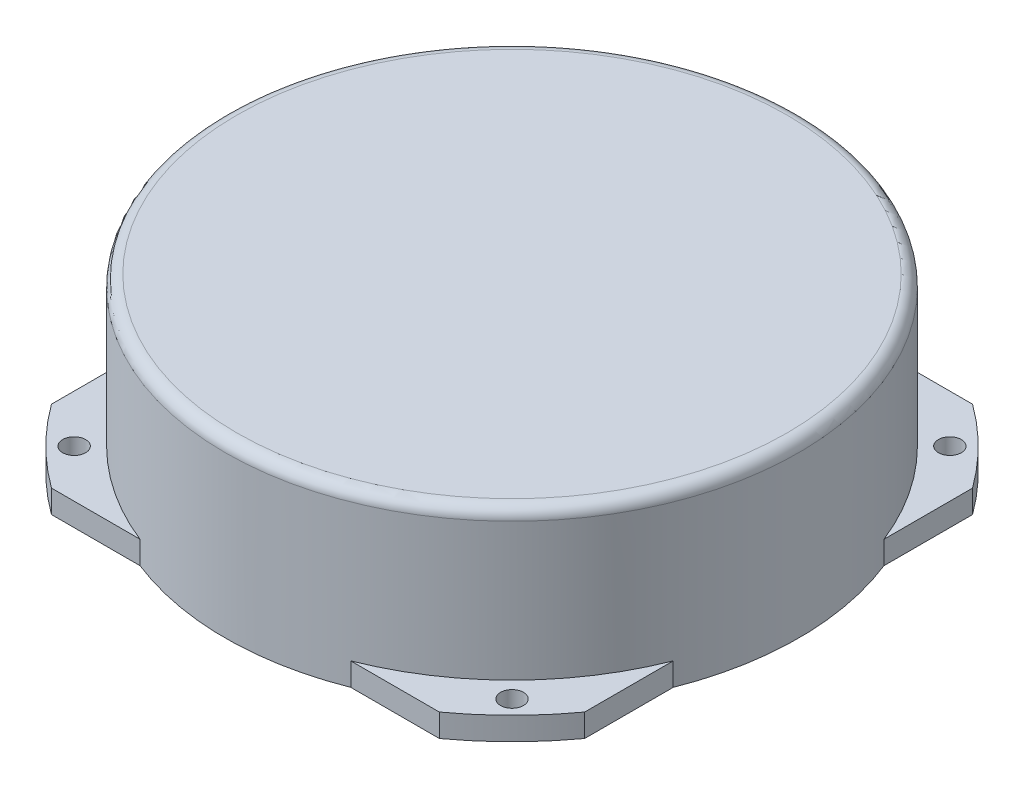
from build123d import *

# Parameters (mm, degrees)
SKETCH1_R           = 50
BOSS_EXTRUDE1_DEPTH = 30
SKETCH1_3_R         = 2
BOSS_EXTRUDE2_DEPTH = 4
FILLET2_R           = 2


with BuildPart() as part:
    # Sketch1 → Boss-Extrude1 (new body)
    with BuildSketch(Plane(origin=(0, 0, 0), x_dir=(1, 0, 0), z_dir=(0, 1, 0))):
        Circle(SKETCH1_R)
    extrude(amount=BOSS_EXTRUDE1_DEPTH)

    # Sketch1<3> → Boss-Extrude2 (add)
    # profile 1 of 4: a face of its own
    with BuildSketch(Plane(origin=(0, 0, 0), x_dir=(1, 0, 0), z_dir=(0, 1, 0))):
        with BuildLine():
            Line((-33.823069051, -46.5), (-18.377975949, -46.5))
            ThreePointArc((-18.377975949, -46.5), (-35.355339059, -35.355339059), (-46.5, -18.377975949))
            Line((-46.5, -18.377975949), (-46.5, -33.823069051))
            ThreePointArc((-46.5, -33.823069051), (-40.658639918, -40.658639918), (-33.823069051, -46.5))
        make_face()
        with Locations((-38.183766184, -38.183766184)):
            Circle(SKETCH1_3_R, mode=Mode.SUBTRACT)
    # profile 2 of 4: a face of its own
    with BuildSketch(Plane(origin=(0, 0, 0), x_dir=(1, 0, 0), z_dir=(0, 1, 0))):
        with BuildLine():
            ThreePointArc((46.5, -18.377975949), (35.355339059, -35.355339059), (18.377975949, -46.5))
            Line((18.377975949, -46.5), (33.823069051, -46.5))
            ThreePointArc((33.823069051, -46.5), (40.658639918, -40.658639918), (46.5, -33.823069051))
            Line((46.5, -33.823069051), (46.5, -18.377975949))
        make_face()
        with Locations((38.183766184, -38.183766184)):
            Circle(SKETCH1_3_R, mode=Mode.SUBTRACT)
    # profile 3 of 4: a face of its own
    with BuildSketch(Plane(origin=(0, 0, 0), x_dir=(1, 0, 0), z_dir=(0, 1, 0))):
        with BuildLine():
            Line((-46.5, 33.823069051), (-46.5, 18.377975949))
            ThreePointArc((-46.5, 18.377975949), (-35.355339059, 35.355339059), (-18.377975949, 46.5))
            Line((-18.377975949, 46.5), (-33.823069051, 46.5))
            ThreePointArc((-33.823069051, 46.5), (-40.658639918, 40.658639918), (-46.5, 33.823069051))
        make_face()
        with Locations((-38.183766184, 38.183766184)):
            Circle(SKETCH1_3_R, mode=Mode.SUBTRACT)
    # profile 4 of 4: a face of its own
    with BuildSketch(Plane(origin=(0, 0, 0), x_dir=(1, 0, 0), z_dir=(0, 1, 0))):
        with BuildLine():
            Line((33.823069051, 46.5), (18.377975949, 46.5))
            ThreePointArc((18.377975949, 46.5), (35.355339059, 35.355339059), (46.5, 18.377975949))
            Line((46.5, 18.377975949), (46.5, 33.823069051))
            ThreePointArc((46.5, 33.823069051), (40.658639918, 40.658639918), (33.823069051, 46.5))
        make_face()
        with Locations((38.183766184, 38.183766184)):
            Circle(SKETCH1_3_R, mode=Mode.SUBTRACT)
    extrude(amount=BOSS_EXTRUDE2_DEPTH)

    # Fillet2
    fillet2_edges = [part.edges().sort_by_distance(p)[0] for p in [
        (-50, 30, 0),
    ]]
    fillet(fillet2_edges, radius=FILLET2_R)


solid = part.part
